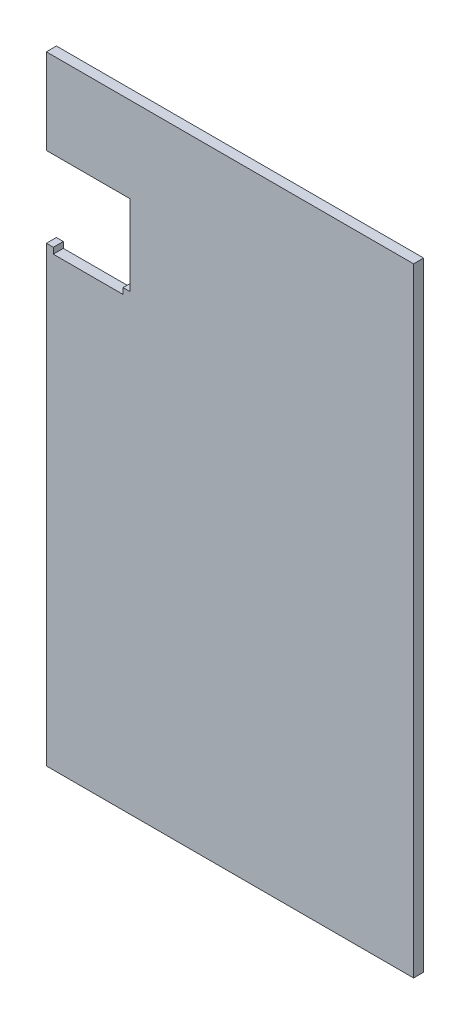
from build123d import *

# Parameters (mm, degrees)
SKETCH1_W           = 109.625714275
SKETCH1_H           = 184.618859475
BOSS_EXTRUDE2_DEPTH = 3
SKETCH2_W           = 25
SKETCH2_H           = 24
CUT_EXTRUDE1_DEPTH  = 10
SKETCH3_W           = 20.825494492
SKETCH3_H           = 1.776733411
CUT_EXTRUDE2_DEPTH  = 10


with BuildPart() as part:
    # Sketch1 → Boss-Extrude2 (new body)
    with BuildSketch(Plane.XY):
        with Locations((22.57686375, -69.619884297)):
            Rectangle(SKETCH1_W, SKETCH1_H)
    extrude(amount=BOSS_EXTRUDE2_DEPTH)

    # Sketch2 → Cut-Extrude1 (cut)
    with BuildSketch(Plane.XY.offset(3)):
        with Locations((-19.735993387, -14.810454559)):
            Rectangle(SKETCH2_W, SKETCH2_H)
    extrude(amount=-CUT_EXTRUDE1_DEPTH, mode=Mode.SUBTRACT)

    # Sketch3 → Cut-Extrude2 (cut)
    with BuildSketch(Plane(origin=(0, 0, 0), x_dir=(-1, 0, 0), z_dir=(0, 0, -1))):
        with Locations((19.755882832, -27.698821265)):
            Rectangle(SKETCH3_W, SKETCH3_H)
    extrude(amount=-CUT_EXTRUDE2_DEPTH, mode=Mode.SUBTRACT)


solid = part.part
